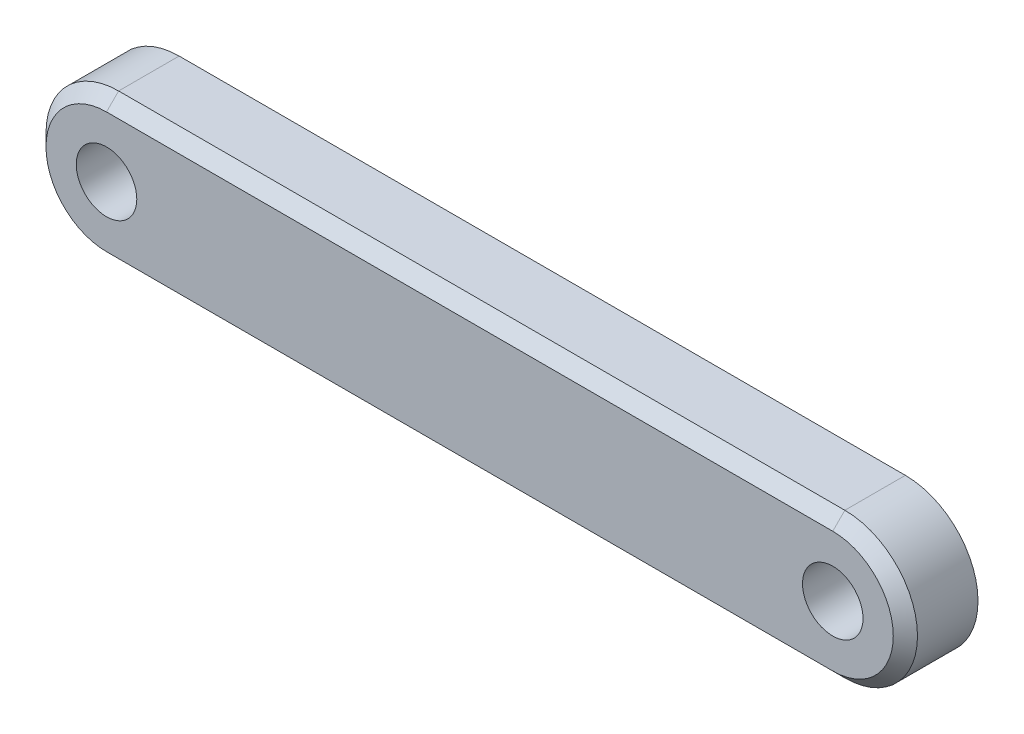
from build123d import *

# Parameters (mm, degrees)
CROQUIS1_R              = 1.25
SALIENTE_EXTRUIR1_DEPTH = 3
CHAFL_N1_SIZE           = 0.5


with BuildPart() as part:
    # Croquis1 → Saliente-Extruir1 (new body)
    with BuildSketch(Plane.XY):
        with BuildLine():
            Line((0, 3), (30, 3))
            ThreePointArc((30, 3), (33, 0), (30, -3))
            Line((30, -3), (0, -3))
            ThreePointArc((0, -3), (-3, 0), (0, 3))
        make_face()
        with Locations((30, 0)):
            Circle(CROQUIS1_R, mode=Mode.SUBTRACT)
        Circle(CROQUIS1_R, mode=Mode.SUBTRACT)
    extrude(amount=SALIENTE_EXTRUIR1_DEPTH)

    # Chaflán1
    chafl_n1_edges = [part.edges().sort_by_distance(p)[0] for p in [
        (33, 0, 3),
        (15, 3, 3),
        (-3, 0, 3),
        (15, -3, 3),
    ]]
    chamfer(chafl_n1_edges, length=CHAFL_N1_SIZE)


solid = part.part
